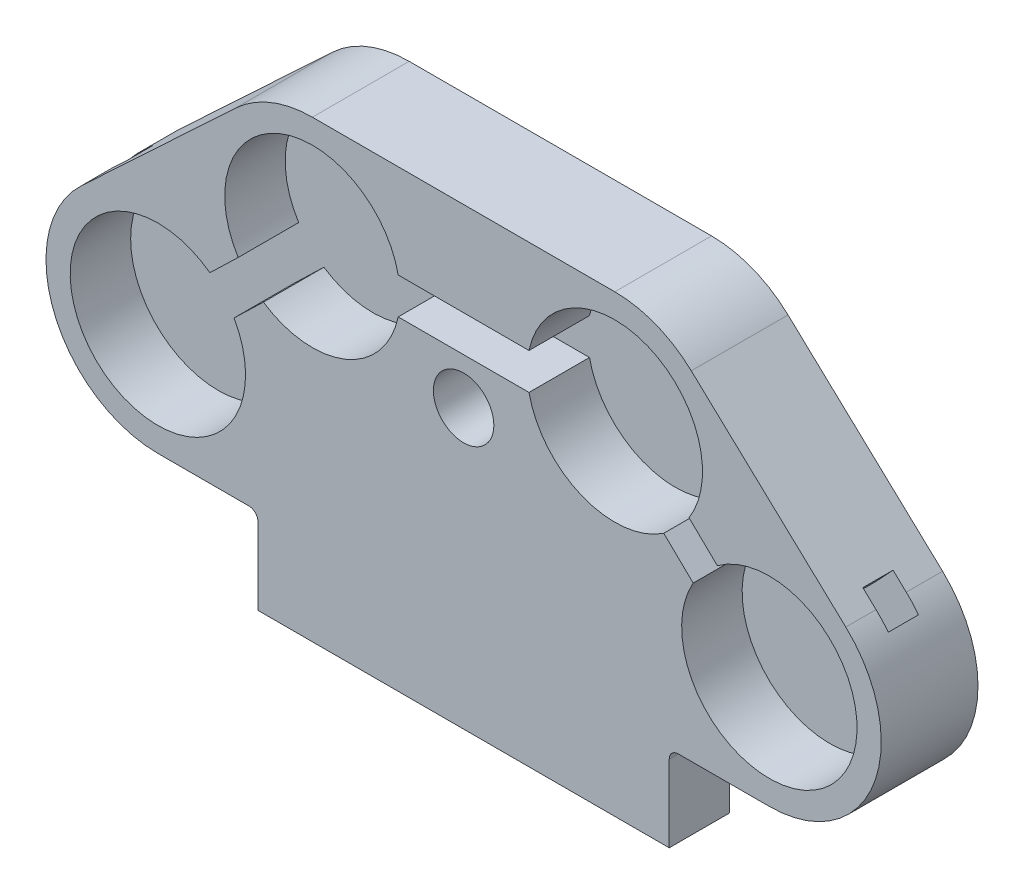
from build123d import *

# Parameters (mm, degrees)
SKETCH1_R           = 7.25
BOSS_EXTRUDE1_DEPTH = 5
BOSS_EXTRUDE2_START = 3
BOSS_EXTRUDE2_DEPTH = 3
SKETCH5_W           = 15.42907023
SKETCH5_H           = 3
CUT_EXTRUDE2_DEPTH  = 5
SKETCH7_W           = 3
SKETCH7_H           = 2.5
CUT_EXTRUDE4_DEPTH  = 10
SKETCH8_R           = 2.5
CUT_EXTRUDE5_DEPTH  = 10


with BuildPart() as part:
    # Sketch1 → Boss-Extrude1 (new body)
    with BuildSketch(Plane.XY):
        with BuildLine():
            ThreePointArc((-25.275752705, 5.100552072), (-33.878856947, 10.952155773), (-31.597213811, 21.10344993))
            Line((-31.597213811, 21.10344993), (-18.821461106, 33.062970941))
            ThreePointArc((-18.821461106, 33.062970941), (-15.898396299, 34.913177324), (-12.5, 35.560073083))
            Line((-12.5, 35.560073083), (0, 35.560073083))
            Line((0, 35.560073083), (0, -2))
            Line((0, -2), (-17, -2))
            Line((-17, -2), (-17, 4.350552072))
            ThreePointArc((-17, 4.350552072), (-17.219669914, 4.880882158), (-17.75, 5.100552072))
            Line((-17.75, 5.100552072), (-25.275752705, 5.100552072))
        make_face()
        with Locations((-12.5, 26.310073083)):
            Circle(SKETCH1_R, mode=Mode.SUBTRACT)
        with Locations((-25.275752705, 14.350552072)):
            Circle(SKETCH1_R, mode=Mode.SUBTRACT)
    boss_extrude1 = extrude(amount=BOSS_EXTRUDE1_DEPTH)

    # Mirror1: Boss-Extrude1 across plane
    add(boss_extrude1.mirror(Plane(origin=(0, 0, 0), x_dir=(0, 0, 1), z_dir=(1, 0, 0))))

    # Sketch3 → Boss-Extrude2 (add)
    with BuildSketch(Plane(origin=(0, 0, 0), x_dir=(-1, 0, 0), z_dir=(0, 0, -1)).offset(BOSS_EXTRUDE2_START)):
        with BuildLine():
            Line((31.597213811, 21.10344993), (18.821461106, 33.062970941))
            ThreePointArc((18.821461106, 33.062970941), (15.898396299, 34.913177324), (12.5, 35.560073083))
            Line((12.5, 35.560073083), (-12.5, 35.560073083))
            ThreePointArc((-12.5, 35.560073083), (-15.898396299, 34.913177324), (-18.821461106, 33.062970941))
            Line((-18.821461106, 33.062970941), (-31.597213811, 21.10344993))
            ThreePointArc((-31.597213811, 21.10344993), (-32.028650564, 8.029090966), (-18.954291599, 7.597654213))
            Line((-18.954291599, 7.597654213), (-6.178538894, 19.557175224))
            Line((-6.178538894, 19.557175224), (-1.366802401, 24.061494071))
            ThreePointArc((-1.366802401, 24.061494071), (0, 24.601408047), (1.366802401, 24.061494071))
            Line((1.366802401, 24.061494071), (6.178538894, 19.557175224))
            Line((6.178538894, 19.557175224), (18.954291599, 7.597654213))
            ThreePointArc((18.954291599, 7.597654213), (32.028650564, 8.029090966), (31.597213811, 21.10344993))
        make_face()
    extrude(amount=-BOSS_EXTRUDE2_DEPTH)

    # Sketch5 → Cut-Extrude2 (cut)
    with BuildSketch(Plane.XY.offset(5)):
        Polygon((-12.873838012, 28.014542797), (-28.664096552, 12.764122156), (-26.57998389, 10.606235594), (-10.78972535, 25.856656236), align=None)
        with Locations((0.808061856, 26.310073083)):
            Rectangle(SKETCH5_W, SKETCH5_H)
        Polygon((26.57998389, 10.606235594), (10.78972535, 25.856656236), (12.873838012, 28.014542797), (28.664096552, 12.764122156), align=None)
    extrude(amount=-CUT_EXTRUDE2_DEPTH, mode=Mode.SUBTRACT)

    # Sketch7 → Cut-Extrude4 (cut)
    with BuildSketch(Plane(origin=(-25.285844423, 27.011591434, 0), x_dir=(0.7300430117299187, 0.6834012006313055, 0), z_dir=(-0.6834012006313055, 0.7300430117299187, 0))):
        with Locations((-8.645202113, -1.25)):
            Rectangle(SKETCH7_W, SKETCH7_H)
    cut_extrude4 = extrude(amount=-CUT_EXTRUDE4_DEPTH, mode=Mode.SUBTRACT)

    # Mirror3: Cut-Extrude4 across plane
    add(cut_extrude4.mirror(Plane(origin=(0, 0, 0), x_dir=(0, 0, 1), z_dir=(1, 0, 0))), mode=Mode.SUBTRACT)

    # Sketch8 → Cut-Extrude5 (cut)
    with BuildSketch(Plane.XY.offset(5)):
        with Locations((0, 21)):
            Circle(SKETCH8_R)
    extrude(amount=-CUT_EXTRUDE5_DEPTH, mode=Mode.SUBTRACT)


solid = part.part
